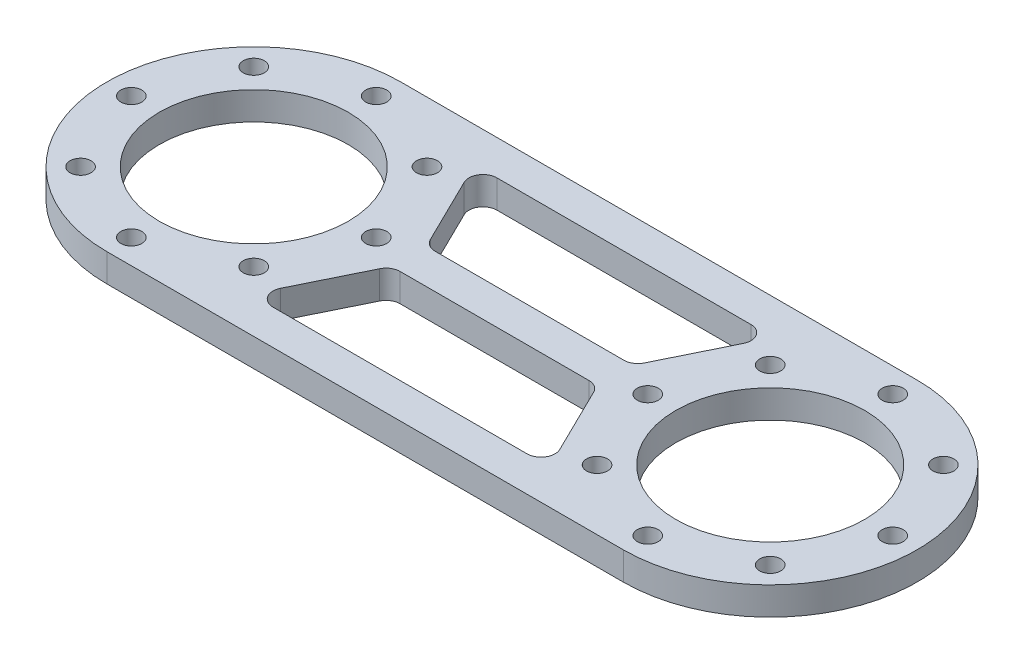
from build123d import *

# Parameters (mm, degrees)
SKETCH_1_R          = 13.5
SKETCH_1_R_2        = 1.5
EXTRUDE_1_DEPTH     = 4
CUT_EXTRUDE_2_DEPTH = 72.640840308
FILLET_1_R          = 2


with BuildPart() as part:
    # 草图1 → 凸台-拉伸1 (new body)
    with BuildSketch(Plane(origin=(0, 0, 0), x_dir=(1, 0, 0), z_dir=(0, 1, 0))):
        with BuildLine():
            Line((36.9, 42), (-36.9, 42))
            ThreePointArc((-36.9, 42), (-57.9, 21), (-36.9, 0))
            Line((-36.9, 0), (36.9, 0))
            ThreePointArc((36.9, 0), (57.9, 21), (36.9, 42))
        make_face()
        with Locations(Location((-36.9, 21, 0), (0, 0, 270))):
            Circle(SKETCH_1_R, mode=Mode.SUBTRACT)
        with Locations(Location((-36.9, 38.5, 0), (0, 0, 270))):
            Circle(SKETCH_1_R_2, mode=Mode.SUBTRACT)
        with Locations(Location((-24.525631329, 33.374368671, 0), (0, 0, 270))):
            Circle(SKETCH_1_R_2, mode=Mode.SUBTRACT)
        with Locations(Location((-19.4, 21, 0), (0, 0, 270))):
            Circle(SKETCH_1_R_2, mode=Mode.SUBTRACT)
        with Locations(Location((-24.525631329, 8.625631329, 0), (0, 0, 270))):
            Circle(SKETCH_1_R_2, mode=Mode.SUBTRACT)
        with Locations(Location((-36.9, 3.5, 0), (0, 0, 270))):
            Circle(SKETCH_1_R_2, mode=Mode.SUBTRACT)
        with Locations(Location((-49.274368671, 8.625631329, 0), (0, 0, 270))):
            Circle(SKETCH_1_R_2, mode=Mode.SUBTRACT)
        with Locations(Location((-54.4, 21, 0), (0, 0, 270))):
            Circle(SKETCH_1_R_2, mode=Mode.SUBTRACT)
        with Locations(Location((-49.274368671, 33.374368671, 0), (0, 0, 270))):
            Circle(SKETCH_1_R_2, mode=Mode.SUBTRACT)
        with Locations(Location((49.274368671, 33.374368671, 0), (0, 0, 90))):
            Circle(SKETCH_1_R_2, mode=Mode.SUBTRACT)
        with Locations(Location((54.4, 21, 0), (0, 0, 90))):
            Circle(SKETCH_1_R_2, mode=Mode.SUBTRACT)
        with Locations(Location((49.274368671, 8.625631329, 0), (0, 0, 90))):
            Circle(SKETCH_1_R_2, mode=Mode.SUBTRACT)
        with Locations(Location((36.9, 3.5, 0), (0, 0, 90))):
            Circle(SKETCH_1_R_2, mode=Mode.SUBTRACT)
        with Locations(Location((24.525631329, 8.625631329, 0), (0, 0, 90))):
            Circle(SKETCH_1_R_2, mode=Mode.SUBTRACT)
        with Locations(Location((19.4, 21, 0), (0, 0, 90))):
            Circle(SKETCH_1_R_2, mode=Mode.SUBTRACT)
        with Locations(Location((24.525631329, 33.374368671, 0), (0, 0, 90))):
            Circle(SKETCH_1_R_2, mode=Mode.SUBTRACT)
        with Locations(Location((36.9, 38.5, 0), (0, 0, 90))):
            Circle(SKETCH_1_R_2, mode=Mode.SUBTRACT)
        with Locations(Location((36.9, 21, 0), (0, 0, 90))):
            Circle(SKETCH_1_R, mode=Mode.SUBTRACT)
    extrude(amount=EXTRUDE_1_DEPTH)

    # 草图2 → 切除-拉伸2 (cut, through all)
    with BuildSketch(Plane(origin=(0, 0, 0), x_dir=(1, 0, 0), z_dir=(0, 1, 0))):
        Polygon((21.358748179, 37), (-21.358748179, 37), (-14.735151519, 23.5), (14.735151519, 23.5), align=None)
        Polygon((21.358748179, 5), (-21.358748179, 5), (-14.735151519, 18.5), (14.735151519, 18.5), align=None)
    extrude(amount=CUT_EXTRUDE_2_DEPTH, mode=Mode.SUBTRACT)

    # 圆角1
    fillet_1_edges = [part.edges().sort_by_distance(p)[0] for p in [
        (-21.358748179, 2, -37),
        (-14.735151519, 2, -23.5),
        (14.735151519, 2, -23.5),
        (21.358748179, 2, -37),
        (21.358748179, 2, -5),
        (14.735151519, 2, -18.5),
        (-14.735151519, 2, -18.5),
        (-21.358748179, 2, -5),
    ]]
    fillet(fillet_1_edges, radius=FILLET_1_R)


solid = part.part
